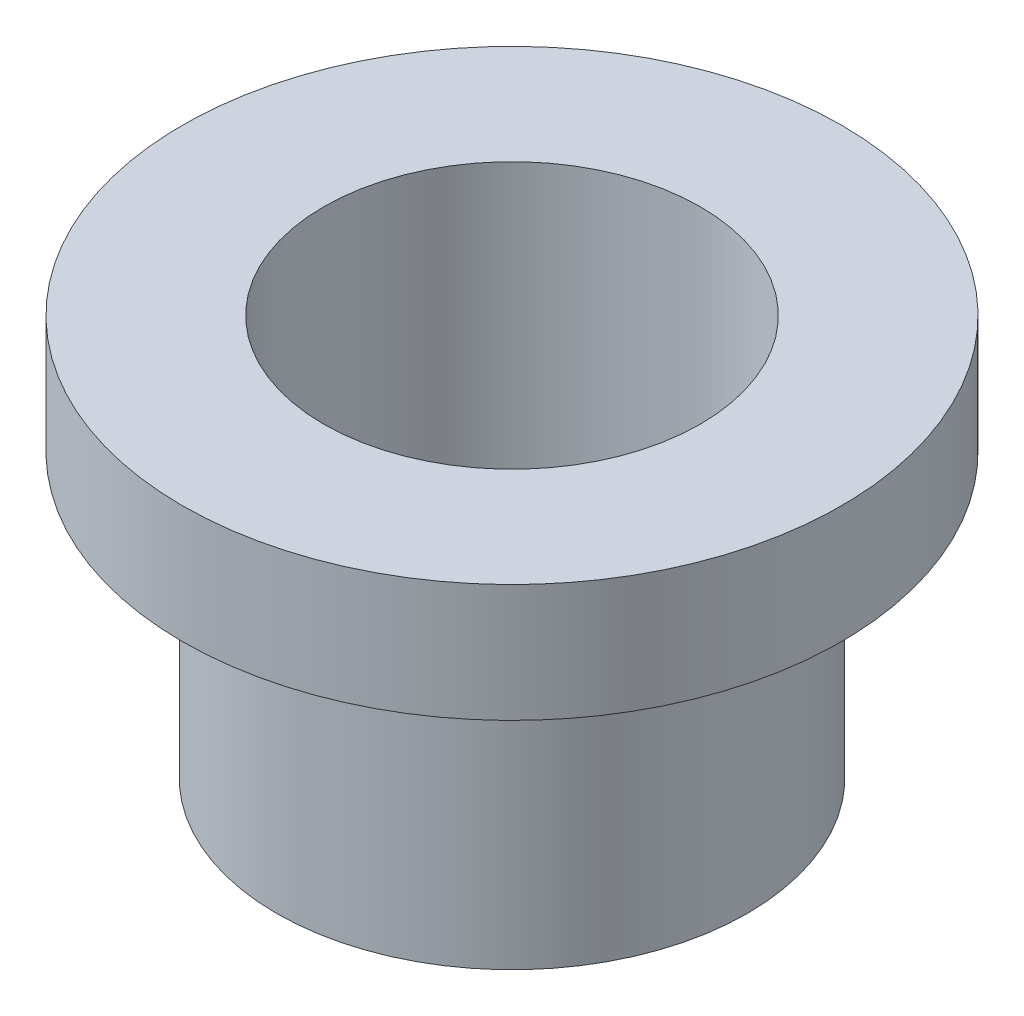
from build123d import *


with BuildPart() as part:
    # Sketch1 → Revolve1 (revolve)
    with BuildSketch(Plane.XY, mode=Mode.PRIVATE) as revolve1_sk:
        Polygon((4, 2.5), (7, 2.5), (7, 0), (5, 0), (5, -6), (4, -6), align=None)
    revolve(revolve1_sk.sketch.rotate(Axis((0, 13.296091569, 0), (0, -1, 0)), 90), axis=Axis((0, 13.296091569, 0), (0, -1, 0)))


solid = part.part
